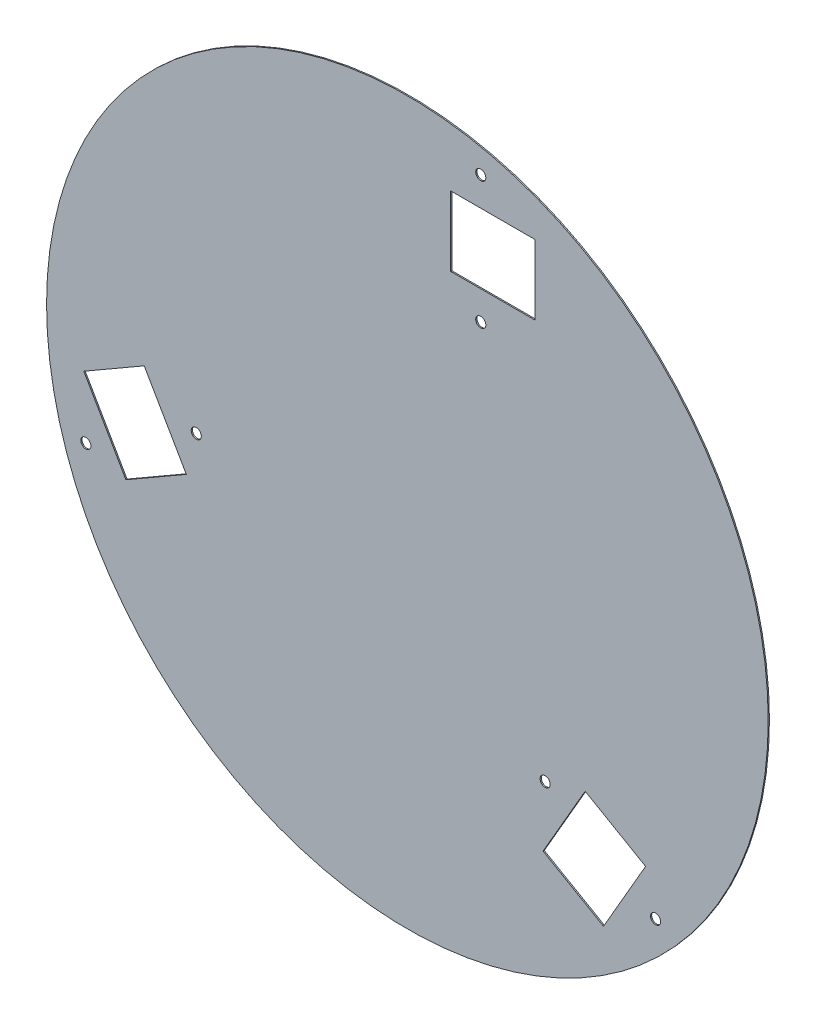
from build123d import *

# Parameters (mm, degrees)
ESQUISSE1_R             = 150
BOSS_EXTRU_1_DEPTH      = 0.5
ESQUISSE6_W             = 35
ESQUISSE6_H             = 29
ENL_V_MAT_EXTRU_2_DEPTH = 3.175
ESQUISSE7_R             = 2.1
ENL_V_MAT_EXTRU_3_DEPTH = 213.132623611


with BuildPart() as part:
    # Esquisse1 → Boss.-Extru.1 (new body)
    with BuildSketch(Plane.XY):
        Circle(ESQUISSE1_R)
    extrude(amount=BOSS_EXTRU_1_DEPTH)

    # Esquisse6 → Enlèv. mat.-Extru.2 (cut)
    with BuildSketch(Plane.XY.offset(0.5)):
        with Locations((35.5, 110.228215567)):
            Rectangle(ESQUISSE6_W, ESQUISSE6_H)
        Polygon((73.90306654, -63.452565052), (56.40306654, -93.763454184), (81.51780325, -108.263454184), (99.01780325, -77.952565052), align=None)
        Polygon((-109.40306654, -1.964761383), (-91.90306654, -32.275650515), (-117.01780325, -46.775650515), (-134.51780325, -16.464761383), align=None)
    extrude(amount=-ENL_V_MAT_EXTRU_2_DEPTH, mode=Mode.SUBTRACT)

    # Esquisse7 → Enlèv. mat.-Extru.3 (cut, through all)
    with BuildSketch(Plane.XY.offset(0.5)):
        with Locations((-133.660108095, -41.950332968)):
            Circle(ESQUISSE7_R)
        with Locations((-87.760761694, -15.450332968)):
            Circle(ESQUISSE7_R)
        with Locations((30.5, 136.728215567)):
            Circle(ESQUISSE7_R)
        with Locations((30.5, 83.728215567)):
            Circle(ESQUISSE7_R)
        with Locations((103.160108095, -94.777882599)):
            Circle(ESQUISSE7_R)
        with Locations((57.260761694, -68.277882599)):
            Circle(ESQUISSE7_R)
    extrude(amount=-ENL_V_MAT_EXTRU_3_DEPTH, mode=Mode.SUBTRACT)


solid = part.part
